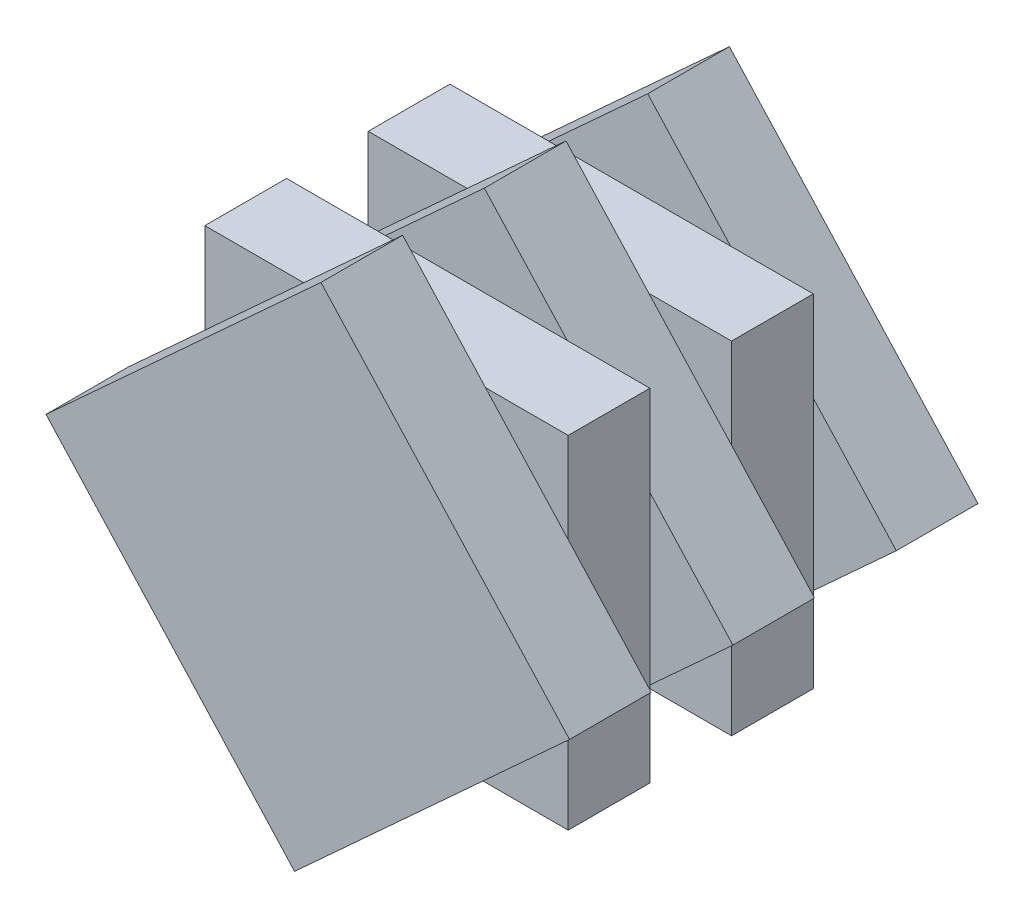
from build123d import *

# Parameters (mm, degrees)
CROQUIS1_W              = 111.196890842
CROQUIS1_H              = 104.63014532
SALIENTE_EXTRUIR1_DEPTH = 25
SALIENTE_EXTRUIR2_DEPTH = 25
MATRIZL4_COUNT          = 2
MATRIZL4_PITCH          = 50
MATRIZL5_COUNT          = 2
MATRIZL5_PITCH          = 50
CROQUIS3_R              = 50.793115706
CORTAR_EXTRUIR4_DEPTH   = 120


with BuildPart() as part:
    # Croquis1 → Saliente-Extruir1 (new body)
    with BuildSketch(Plane.XY):
        Rectangle(CROQUIS1_W, CROQUIS1_H)
    saliente_extruir1 = extrude(amount=SALIENTE_EXTRUIR1_DEPTH)

    # Croquis2 → Saliente-Extruir2 (add)
    with BuildSketch(Plane.XY.offset(25)):
        Polygon((-3.132824134, -80.10377536), (81.011557784, -3.059075666), (4.937773514, 80.024920806), (-79.206608404, 2.980221112), align=None)
    saliente_extruir2 = extrude(amount=SALIENTE_EXTRUIR2_DEPTH)

    # MatrizL4: Saliente-Extruir1, Saliente-Extruir2 ×2
    with Locations(*[(0, 0, i * MATRIZL4_PITCH) for i in range(1, MATRIZL4_COUNT)]):
        add(saliente_extruir1)
        add(saliente_extruir2)

    # MatrizL5: Saliente-Extruir2 ×2
    with Locations(*[(0, 0, -i * MATRIZL5_PITCH) for i in range(1, MATRIZL5_COUNT)]):
        add(saliente_extruir2)

    # Croquis3 → Cortar-Extruir4 (cut)
    with BuildSketch(Plane(origin=(0, 0, -25), x_dir=(-1, 0, 0), z_dir=(0, 0, -1))):
        Circle(CROQUIS3_R)
    extrude(amount=-CORTAR_EXTRUIR4_DEPTH, mode=Mode.SUBTRACT)


solid = part.part
